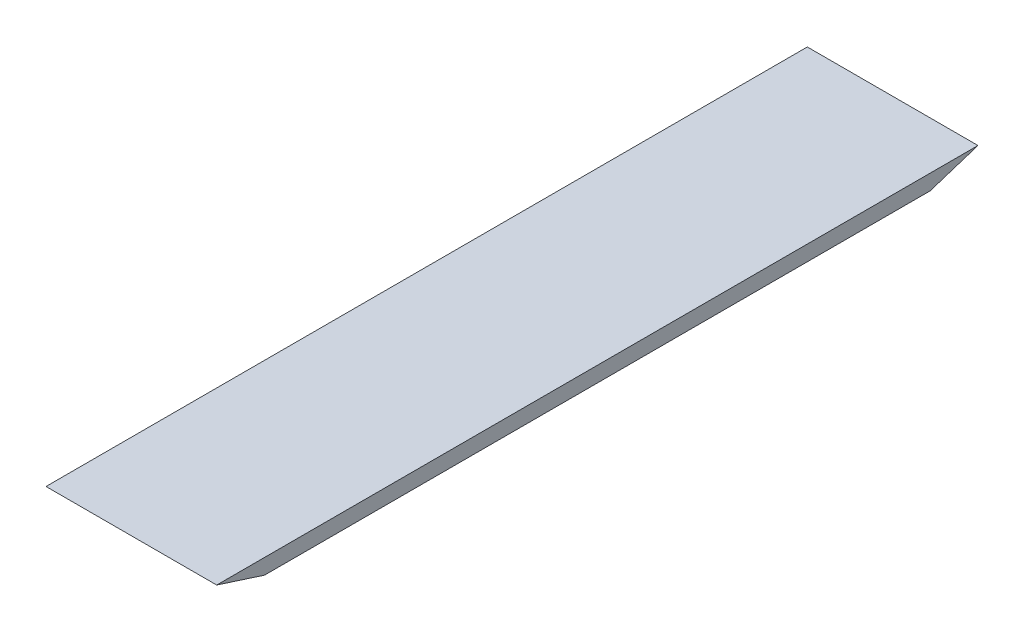
from build123d import *

# Parameters (mm, degrees)
BOSS_EXTRUDE1_DEPTH = 100


with BuildPart() as part:
    # Sketch1 → Boss-Extrude1 (new body)
    with BuildSketch(Plane(origin=(0, 0, 0), x_dir=(0, 0, -1), z_dir=(1, 0, 0))):
        Polygon((0, 0), (446, 0), (418, -9), (28, -9), align=None)
    extrude(amount=BOSS_EXTRUDE1_DEPTH)


solid = part.part
